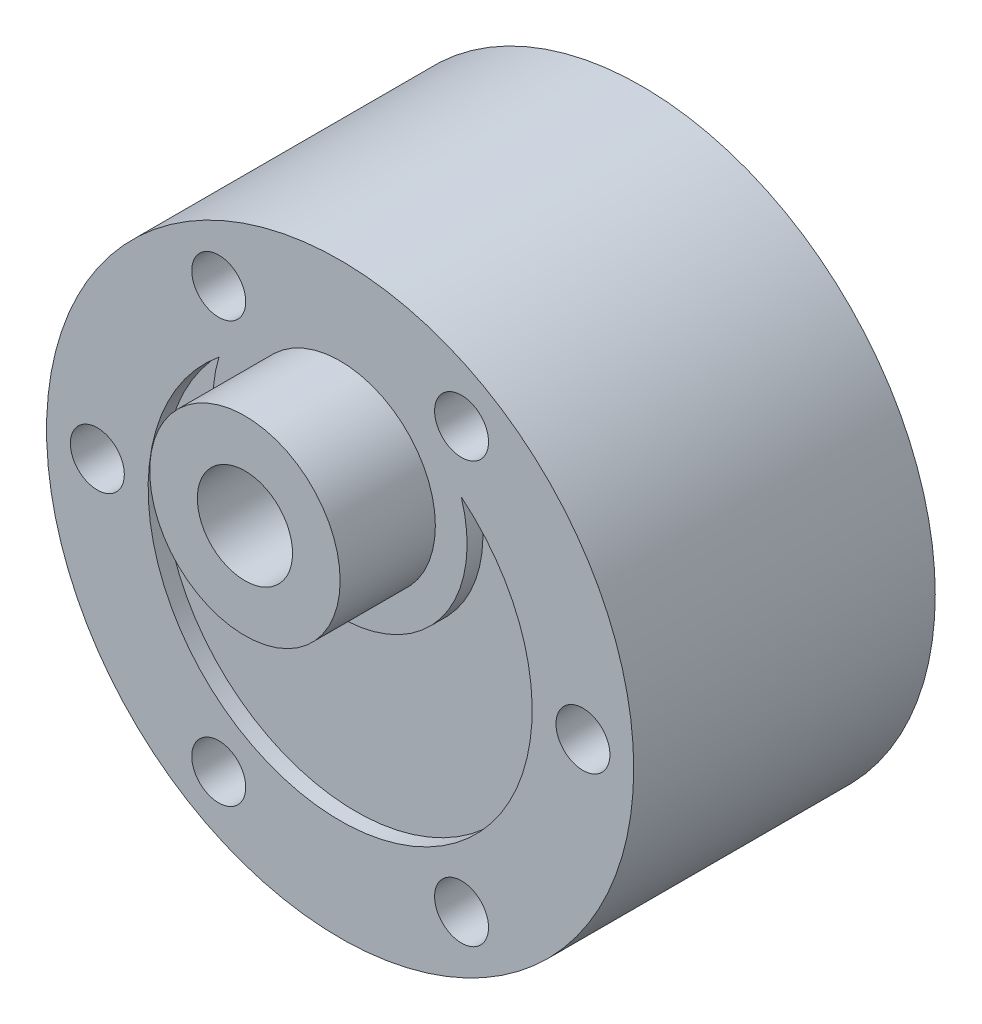
from build123d import *

# Parameters (mm, degrees)
SKETCH1_R                        = 18.5
BOSS_EXTRUDE1_DEPTH              = 19
SKETCH4_R                        = 6
BOSS_EXTRUDE4_DEPTH              = 6
CUT_EXTRUDE2_DEPTH               = 1
TALADRO_DE_MARGEN_PARA_M31_D     = 3.4
TALADRO_DE_MARGEN_PARA_M31_DEPTH = 6
TALADRO_DE_MARGEN_PARA_M31_TIP   = 1.021463052
CROQUIS1_R                       = 18
CORTAR_EXTRUIR2_DEPTH            = 12
CORTAR_EXTRUIR3_REACH            = 38.187
CROQUIS2_R                       = 3
CROQUIS3_R                       = 18
SALIENTE_EXTRUIR1_DEPTH          = 0.5
SKETCH11_R                       = 2
CUT_EXTRUDE3_DEPTH               = 10
SKETCH12_W                       = 12.5
SKETCH12_H                       = 1.5
CUT_EXTRUDE4_DEPTH               = 0.15
SKETCH13_R                       = 6
CUT_EXTRUDE5_DEPTH               = 10
SKETCH14_R                       = 2.25
SKETCH14_R_2                     = 2
BOSS_EXTRUDE5_DEPTH              = 1


with BuildPart() as part:
    # Sketch1 → Boss-Extrude1 (new body)
    with BuildSketch(Plane.XY):
        Circle(SKETCH1_R)
    extrude(amount=BOSS_EXTRUDE1_DEPTH)

    # Sketch4 → Boss-Extrude4 (add)
    with BuildSketch(Plane.XY.offset(19)):
        with Locations((0, 7)):
            Circle(SKETCH4_R)
    extrude(amount=BOSS_EXTRUDE4_DEPTH)

    # Sketch8 → Cut-Extrude2 (cut)
    with BuildSketch(Plane.XY.offset(19)):
        with BuildLine():
            ThreePointArc((7.635768375, 9.386428571), (0, -12.1), (-7.635768375, 9.386428571))
            ThreePointArc((-7.635768375, 9.386428571), (0, -1), (7.635768375, 9.386428571))
        make_face()
    extrude(amount=-CUT_EXTRUDE2_DEPTH, mode=Mode.SUBTRACT)

    # Taladro de margen para M31
    with Locations(Plane.XY.offset(19)):
        with Locations((7.65, -13.250188678), (-7.65, -13.250188678), (-15.3, 0), (-7.65, 13.250188678), (15.3, 0), (7.65, 13.250188678)):
            Hole(TALADRO_DE_MARGEN_PARA_M31_D / 2, depth=TALADRO_DE_MARGEN_PARA_M31_DEPTH)
            with Locations((0, 0, -(TALADRO_DE_MARGEN_PARA_M31_DEPTH + TALADRO_DE_MARGEN_PARA_M31_TIP / 2))):  # 118° drill point
                Cone(0, TALADRO_DE_MARGEN_PARA_M31_D / 2, TALADRO_DE_MARGEN_PARA_M31_TIP, mode=Mode.SUBTRACT)

    # Croquis1 → Cortar-Extruir2 (cut)
    with BuildSketch(Plane(origin=(0, 0, 0), x_dir=(-1, 0, 0), z_dir=(0, 0, -1))):
        Circle(CROQUIS1_R)
    extrude(amount=-CORTAR_EXTRUIR2_DEPTH, mode=Mode.SUBTRACT)

    # Croquis2 → Cortar-Extruir3 (cut, up to next)
    with BuildSketch(Plane.XY.offset(25), mode=Mode.PRIVATE) as cortar_extruir3_sk1:
        with Locations((0, 7)):
            Circle(CROQUIS2_R)
    cortar_extruir3_tool1 = extrude(cortar_extruir3_sk1.sketch, amount=-CORTAR_EXTRUIR3_REACH, mode=Mode.PRIVATE) & part.part
    add(cortar_extruir3_tool1.solids().sort_by_distance((0, 7, 25))[0], mode=Mode.SUBTRACT)

    # Croquis3 → Saliente-Extruir1 (add)
    with BuildSketch(Plane(origin=(0, 0, 0), x_dir=(-1, 0, 0), z_dir=(0, 0, -1))):
        Circle(CROQUIS3_R)
    extrude(amount=-SALIENTE_EXTRUIR1_DEPTH)

    # Sketch11 → Cut-Extrude3 (cut)
    with BuildSketch(Plane(origin=(0, 0, 0), x_dir=(-1, 0, 0), z_dir=(0, 0, -1))):
        Circle(SKETCH11_R)
    extrude(amount=-CUT_EXTRUDE3_DEPTH, mode=Mode.SUBTRACT)

    # Sketch12 → Cut-Extrude4 (cut)
    with BuildSketch(Plane(origin=(0, 0, 0), x_dir=(-1, 0, 0), z_dir=(0, 0, -1))):
        with Locations((0, -15)):
            Rectangle(SKETCH12_W, SKETCH12_H)
    extrude(amount=-CUT_EXTRUDE4_DEPTH, mode=Mode.SUBTRACT)

    # Sketch13 → Cut-Extrude5 (cut)
    with BuildSketch(Plane(origin=(0, 0, 0), x_dir=(-1, 0, 0), z_dir=(0, 0, -1))):
        Circle(SKETCH13_R)
    extrude(amount=-CUT_EXTRUDE5_DEPTH, mode=Mode.SUBTRACT)

    # Sketch14 → Boss-Extrude5 (add)
    with BuildSketch(Plane(origin=(0, 0, 12), x_dir=(-1, 0, 0), z_dir=(0, 0, -1))):
        with Locations((0, -5.15)):
            Circle(SKETCH14_R)
        with Locations((0, -5.15)):
            Circle(SKETCH14_R_2, mode=Mode.SUBTRACT)
    extrude(amount=BOSS_EXTRUDE5_DEPTH)


solid = part.part
